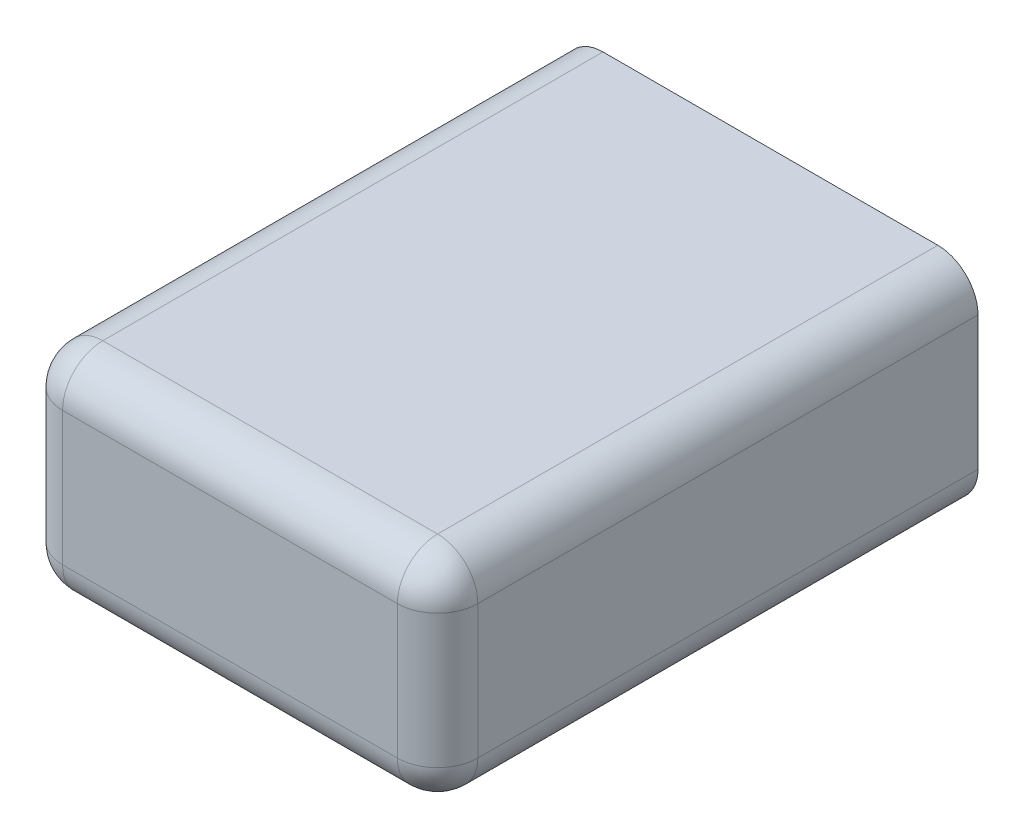
from build123d import *

# Parameters (mm, degrees)
SCHIZZO1_W                   = 16.52
SCHIZZO1_H                   = 8.52
SCHIZZO1_W_2                 = 14
SCHIZZO1_H_2                 = 6
ESTRUSIONE_SOTTILE1_DEPTH    = 20
SCHIZZO2_W                   = 16.52
SCHIZZO2_H                   = 8.52
ESTRUSIONE_ESTRUSIONE1_DEPTH = 1.5
RACCORDO1_R                  = 1.6
RACCORDO2_R                  = 0.5


with BuildPart() as part:
    # Schizzo1 → Estrusione-Sottile1 (new body)
    with BuildSketch(Plane.XY):
        Rectangle(SCHIZZO1_W, SCHIZZO1_H)
        Rectangle(SCHIZZO1_W_2, SCHIZZO1_H_2, mode=Mode.SUBTRACT)
    extrude(amount=ESTRUSIONE_SOTTILE1_DEPTH)

    # Schizzo2 → Estrusione-Estrusione1 (add)
    with BuildSketch(Plane.XY.offset(20)):
        Rectangle(SCHIZZO2_W, SCHIZZO2_H)
    extrude(amount=ESTRUSIONE_ESTRUSIONE1_DEPTH)

    # Raccordo1
    raccordo1_edges = [part.edges().sort_by_distance(p)[0] for p in [
        (0, -4.26, 21.5),
        (8.26, 0, 21.5),
        (0, 4.26, 21.5),
        (-8.26, 0, 21.5),
        (-8.26, 4.26, 10.75),
        (8.26, 4.26, 10.75),
        (8.26, -4.26, 10.75),
        (-8.26, -4.26, 10.75),
    ]]
    fillet(raccordo1_edges, radius=RACCORDO1_R)

    # Raccordo2
    raccordo2_edges = [part.edges().sort_by_distance(p)[0] for p in [
        (-7, 3, 10),
        (-7, -3, 10),
        (7, -3, 10),
        (7, 3, 10),
        (-7, 0, 20),
        (0, -3, 20),
        (7, 0, 20),
        (0, 3, 20),
    ]]
    fillet(raccordo2_edges, radius=RACCORDO2_R)


solid = part.part
